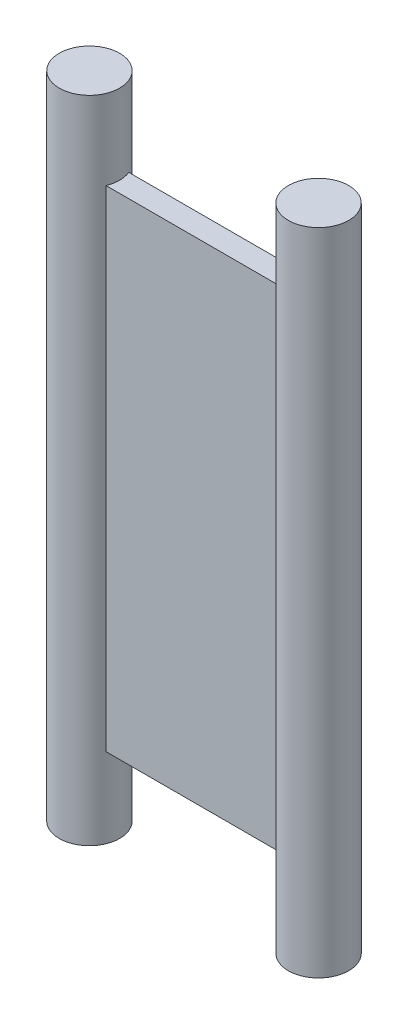
from build123d import *

# Parameters (mm, degrees)
SKETCH1_W           = 10.047
SKETCH1_H           = 1
BOSS_EXTRUDE1_DEPTH = 21.5
SKETCH2_R           = 1.325
BOSS_EXTRUDE2_DEPTH = 14.25


with BuildPart() as part:
    # Sketch1 → Boss-Extrude1 (new body)
    with BuildSketch(Plane(origin=(0, 0, 0), x_dir=(1, 0, 0), z_dir=(0, 1, 0))):
        Rectangle(SKETCH1_W, SKETCH1_H)
    extrude(amount=BOSS_EXTRUDE1_DEPTH)

    # Sketch2 → Boss-Extrude2 (add, symmetric)
    with BuildSketch(Plane(origin=(0, 10.75, 0), x_dir=(1, 0, 0), z_dir=(0, 1, 0))):
        with Locations(Location((-5.0235, 0, 0), (0, 0, 270))):
            Circle(SKETCH2_R)
        with Locations(Location((5.0235, 0, 0), (0, 0, 270))):
            Circle(SKETCH2_R)
    extrude(amount=BOSS_EXTRUDE2_DEPTH, both=True)


solid = part.part
